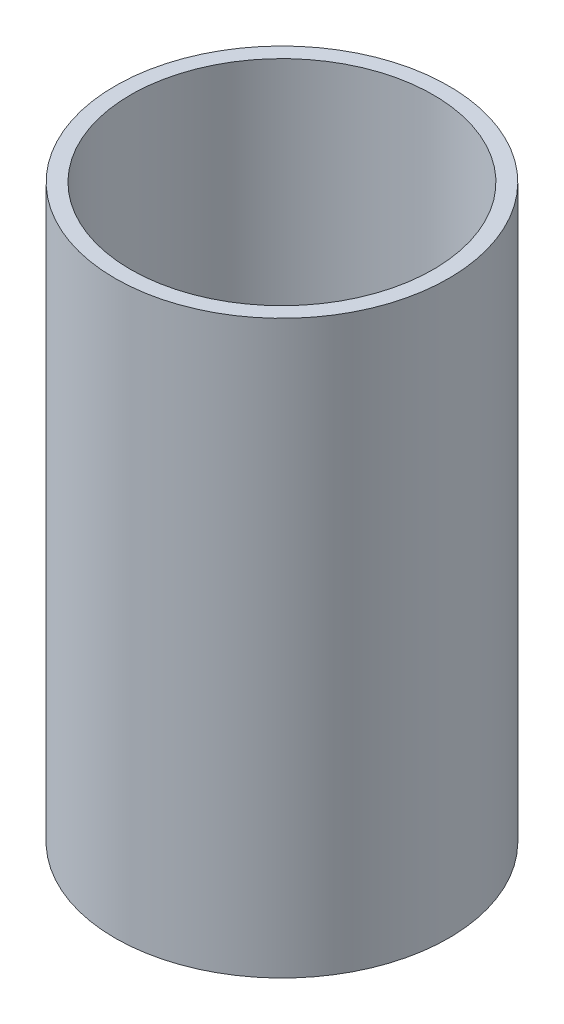
from build123d import *

# Parameters (mm, degrees)
SKETCH1_R            = 10.8
SKETCH1_R_2          = 9.8
BOSS_EXTRUDE7_DEPTH  = 37
SKETCH1_10_R         = 9.8
BOSS_EXTRUDE8_DEPTH  = 1
BOSS_EXTRUDE9_DEPTH  = 5
SKETCH1_13_W         = 3
SKETCH1_13_H         = 0.75
BOSS_EXTRUDE10_DEPTH = 2
SKETCH1_14_W         = 4.25
SKETCH1_14_H         = 2.6
BOSS_EXTRUDE11_DEPTH = 0.5
BOSS_EXTRUDE12_DEPTH = 20


with BuildPart() as part:
    # Sketch1 → Boss-Extrude7 (new body)
    with BuildSketch(Plane(origin=(0, 0, 0), x_dir=(1, 0, 0), z_dir=(0, 1, 0))):
        Circle(SKETCH1_R)
        Circle(SKETCH1_R_2, mode=Mode.SUBTRACT)
    extrude(amount=BOSS_EXTRUDE7_DEPTH)

    # Sketch1<10> → Boss-Extrude8 (add)
    with BuildSketch(Plane(origin=(0, 0, 0), x_dir=(1, 0, 0), z_dir=(0, 1, 0))):
        Circle(SKETCH1_10_R)
        Polygon((-2.35, 0.5), (-5.35, 0.5), (-7.35, 0.5), (-7.35, 4.6), (-5.35, 4.6), (5.35, 4.6), (7.35, 4.6), (7.35, 0.5), (5.35, 0.5), (2.35, 0.5), (2.35, -1.25), (-2.35, -1.25), align=None, mode=Mode.SUBTRACT)
    extrude(amount=BOSS_EXTRUDE8_DEPTH)

    # Sketch1<12> → Boss-Extrude9 (add)
    with BuildSketch(Plane(origin=(0, 0, 0), x_dir=(1, 0, 0), z_dir=(0, 1, 0))):
        Polygon((-5.35, 0.5), (-5.35, 1.25), (-6.6, 1.25), (-6.6, 3.85), (6.6, 3.85), (6.6, 1.25), (5.35, 1.25), (5.35, 0.5), (7.35, 0.5), (7.35, 4.6), (-7.35, 4.6), (-7.35, 0.5), align=None)
    extrude(amount=BOSS_EXTRUDE9_DEPTH)

    # Sketch1<13> → Boss-Extrude10 (add)
    with BuildSketch(Plane(origin=(0, 0, 0), x_dir=(1, 0, 0), z_dir=(0, 1, 0))):
        with Locations((-3.85, 0.875)):
            Rectangle(SKETCH1_13_W, SKETCH1_13_H)
        with Locations((3.85, 0.875)):
            Rectangle(SKETCH1_13_W, SKETCH1_13_H)
    extrude(amount=BOSS_EXTRUDE10_DEPTH)

    # Sketch1<14> → Boss-Extrude11 (add)
    with BuildSketch(Plane(origin=(0, 0, 0), x_dir=(1, 0, 0), z_dir=(0, 1, 0))):
        with Locations((-4.475, 2.55)):
            Rectangle(SKETCH1_14_W, SKETCH1_14_H)
        with Locations((4.475, 2.55)):
            Rectangle(SKETCH1_14_W, SKETCH1_14_H)
    extrude(amount=BOSS_EXTRUDE11_DEPTH)

    # Sketch1<15> → Boss-Extrude12 (add)
    with BuildSketch(Plane(origin=(0, 0, 0), x_dir=(1, 0, 0), z_dir=(0, 1, 0))):
        Polygon((-5.35, 0.5), (-5.35, 1.25), (-6.6, 1.25), (-6.6, 3.85), (-5.35, 3.85), (-5.35, 4.6), (-7.35, 4.6), (-7.35, 0.5), align=None)
        Polygon((5.35, 4.6), (5.35, 3.85), (6.6, 3.85), (6.6, 1.25), (5.35, 1.25), (5.35, 0.5), (7.35, 0.5), (7.35, 4.6), align=None)
    extrude(amount=BOSS_EXTRUDE12_DEPTH)


solid = part.part
